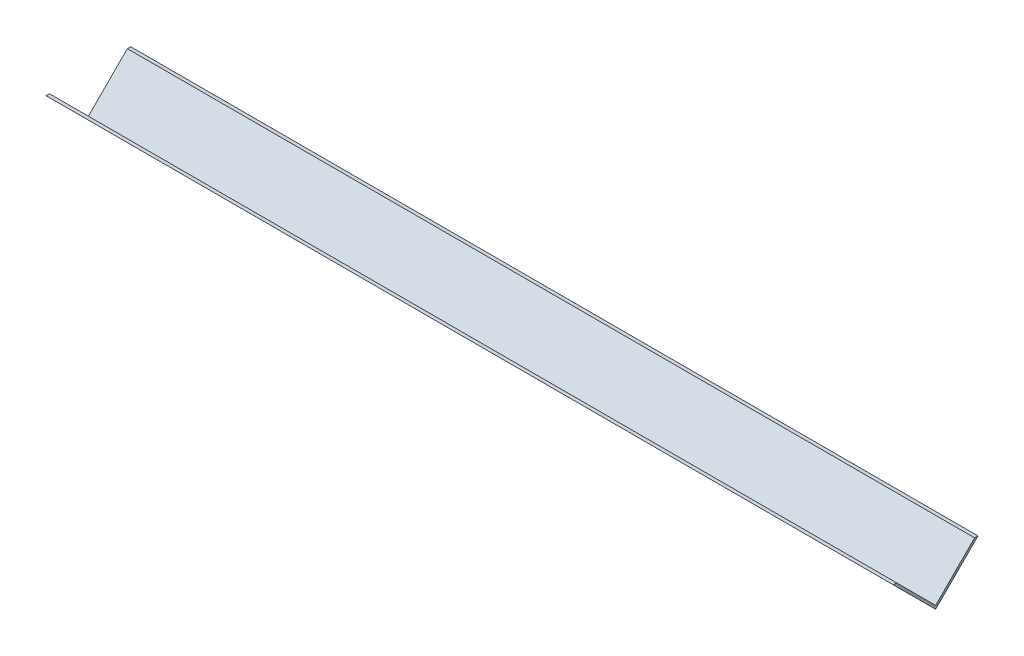
from build123d import *

# Parameters (mm, degrees)
SALIENTE_EXTRUIR1_DEPTH = 400


with BuildPart() as part:
    # Croquis1 → Saliente-Extruir1 (new body)
    with BuildSketch(Plane(origin=(0, 0, 0), x_dir=(0, 0, -1), z_dir=(1, 0, 0))):
        Polygon((0, 0), (-20, 20), (-18.405161719, 20), (0, 1.594838281), (18.405161719, 20), (20, 20), align=None)
    extrude(amount=SALIENTE_EXTRUIR1_DEPTH)


solid = part.part
